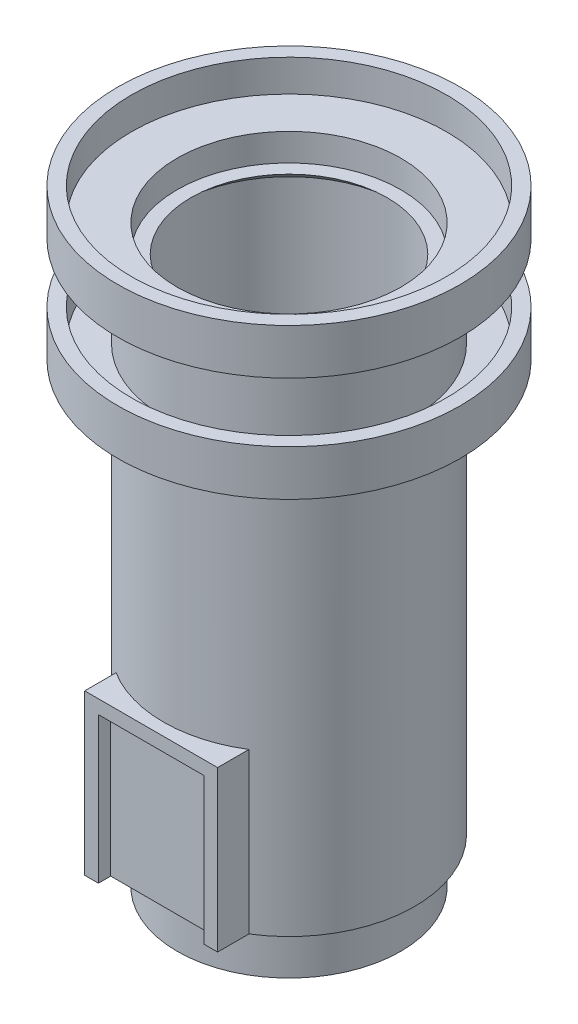
from build123d import *

# Parameters (mm, degrees)
SALIENTE_EXTRUIR1_DEPTH = 35
CROQUIS3_W              = 23.109686168
CROQUIS3_H              = 32
CORTAR_EXTRUIR1_DEPTH   = 2.7


with BuildPart() as part:
    # Croquis1 → Revolución1 (revolve)
    with BuildSketch(Plane.XY):
        Polygon((-39.212995514, 3.519897437), (-39.212995514, 16.519897437), (-42.212995514, 16.519897437), (-42.212995514, 120.917625562), (-39.212995514, 123.519897437), (-42.212995514, 123.519897437), (-42.212995514, 129.519897437), (-52.212995514, 129.519897437), (-52.212995514, 136.519897437), (-55.212995514, 136.519897437), (-55.212995514, 126.519897437), (-45.212995514, 123.519897437), (-45.212995514, 106.519897437), (-52.212995514, 106.519897437), (-52.212995514, 113.519897437), (-55.212995514, 113.519897437), (-55.212995514, 103.519897437), (-45.212995514, 100.519897437), (-45.212995514, 13.519897437), (-42.212995514, 13.519897437), (-42.212995514, 3.519897437), align=None)
    revolve(axis=Axis((-17.712995514, 104.262295082, 0), (0, -1, 0)))

    # Croquis2 → Saliente-Extruir1 (add)
    with BuildSketch(Plane.XZ.offset(-13.519897437)):
        with BuildLine():
            Line((-32.267838598, 23.332521141), (-32.267838598, 30.202521141))
            Line((-32.267838598, 30.202521141), (-3.15815243, 30.202521141))
            Line((-3.15815243, 30.202521141), (-3.15815243, 23.332521141))
            ThreePointArc((-3.15815243, 23.332521141), (-17.712995514, 27.5), (-32.267838598, 23.332521141))
        make_face()
    extrude(amount=-SALIENTE_EXTRUIR1_DEPTH)

    # Croquis3 → Cortar-Extruir1 (cut)
    with BuildSketch(Plane.XY.offset(30.202521141)):
        with Locations((-17.712995514, 29.519897437)):
            Rectangle(CROQUIS3_W, CROQUIS3_H)
    extrude(amount=-CORTAR_EXTRUIR1_DEPTH, mode=Mode.SUBTRACT)


solid = part.part
